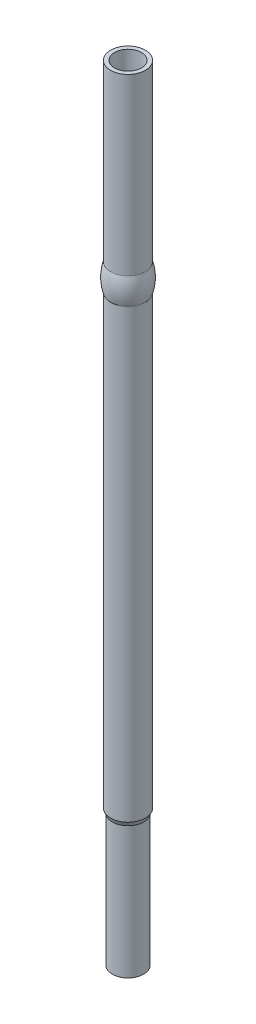
from build123d import *


with BuildPart() as part:
    # Sketch1 → Revolve1 (revolve)
    with BuildSketch(Plane(origin=(0, 0, 0), x_dir=(0, 0, -1), z_dir=(1, 0, 0)), mode=Mode.PRIVATE) as revolve1_sk:
        with BuildLine():
            Line((0.51, 0), (0.51, -18.54))
            Line((0.51, -18.54), (0, -18.54))
            Line((0, -18.54), (0, -24.72))
            Line((0, -24.72), (0.455, -24.72))
            Line((0.455, -24.72), (0.455, -29.72))
            Line((0.455, -29.72), (0.595, -29.72))
            Line((0.595, -29.72), (0.595, -24.72))
            Line((0.595, -24.72), (0.66, -24.56))
            Line((0.66, -24.56), (0.66, -7.62))
            ThreePointArc((0.66, -7.62), (0.735, -7.12), (0.66, -6.62))
            Line((0.66, -6.62), (0.66, 0))
            Line((0.66, 0), (0.51, 0))
        make_face()
    revolve(revolve1_sk.sketch.rotate(Axis((0, -18.54, 0), (0, -1, 0)), 180), axis=Axis((0, -18.54, 0), (0, -1, 0)))


solid = part.part
